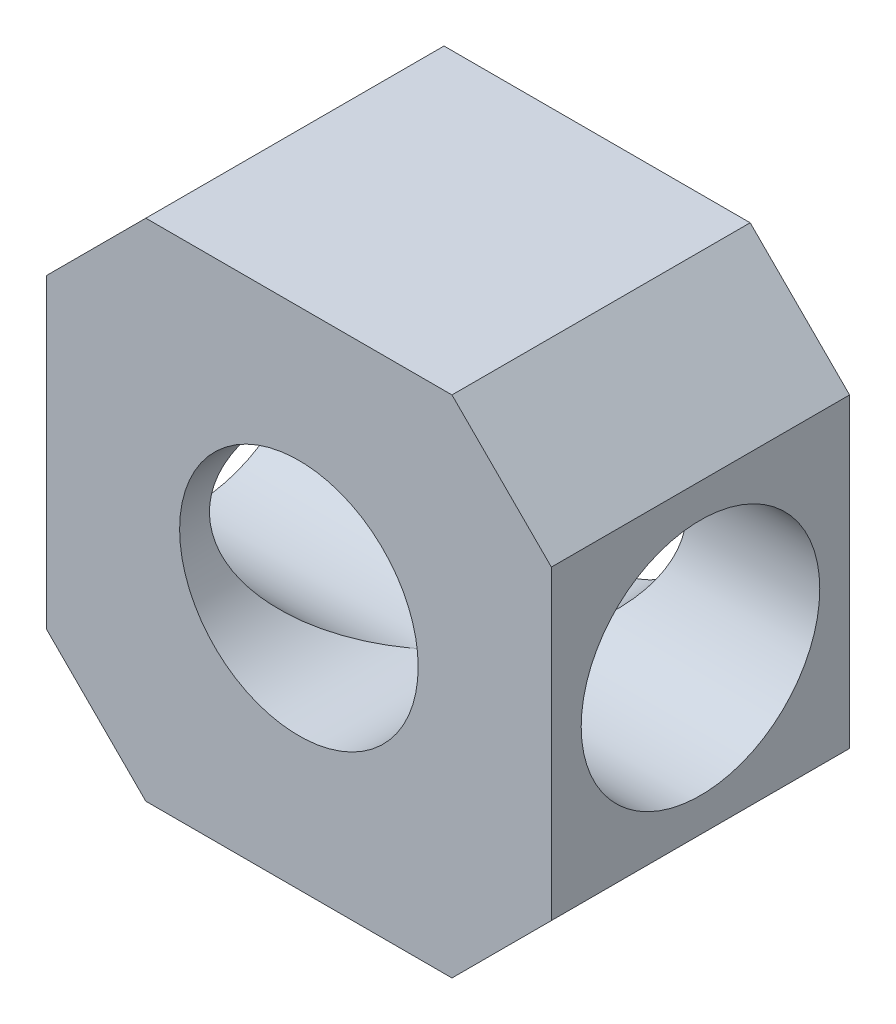
from build123d import *

# Parameters (mm, degrees)
SKETCH1_W           = 25.4
SKETCH1_H           = 25.4
BOSS_EXTRUDE1_DEPTH = 15
CHAMFER1_SIZE       = 5
SKETCH2_R           = 6
CUT_EXTRUDE1_DEPTH  = 39.927111375
SKETCH3_R           = 6
CUT_EXTRUDE2_DEPTH  = 39.927111375


with BuildPart() as part:
    # Sketch1 → Boss-Extrude1 (new body)
    with BuildSketch(Plane.XY):
        with Locations((-12.7, 12.7)):
            Rectangle(SKETCH1_W, SKETCH1_H)
    extrude(amount=BOSS_EXTRUDE1_DEPTH)

    # Chamfer1
    chamfer1_edges = [part.edges().sort_by_distance(p)[0] for p in [
        (0, 25.4, 7.5),
        (0, 0, 7.5),
        (-25.4, 0, 7.5),
        (-25.4, 25.4, 7.5),
    ]]
    chamfer(chamfer1_edges, length=CHAMFER1_SIZE)

    # Sketch2 → Cut-Extrude1 (cut, through all)
    with BuildSketch(Plane.XY.offset(15)):
        with Locations((-12.7, 12.7)):
            Circle(SKETCH2_R)
    extrude(amount=-CUT_EXTRUDE1_DEPTH, mode=Mode.SUBTRACT)

    # Sketch3 → Cut-Extrude2 (cut, through all)
    with BuildSketch(Plane(origin=(0, 0, 0), x_dir=(0, 0, -1), z_dir=(1, 0, 0))):
        with Locations((-7.5, 12.7)):
            Circle(SKETCH3_R)
    extrude(amount=-CUT_EXTRUDE2_DEPTH, mode=Mode.SUBTRACT)


solid = part.part
